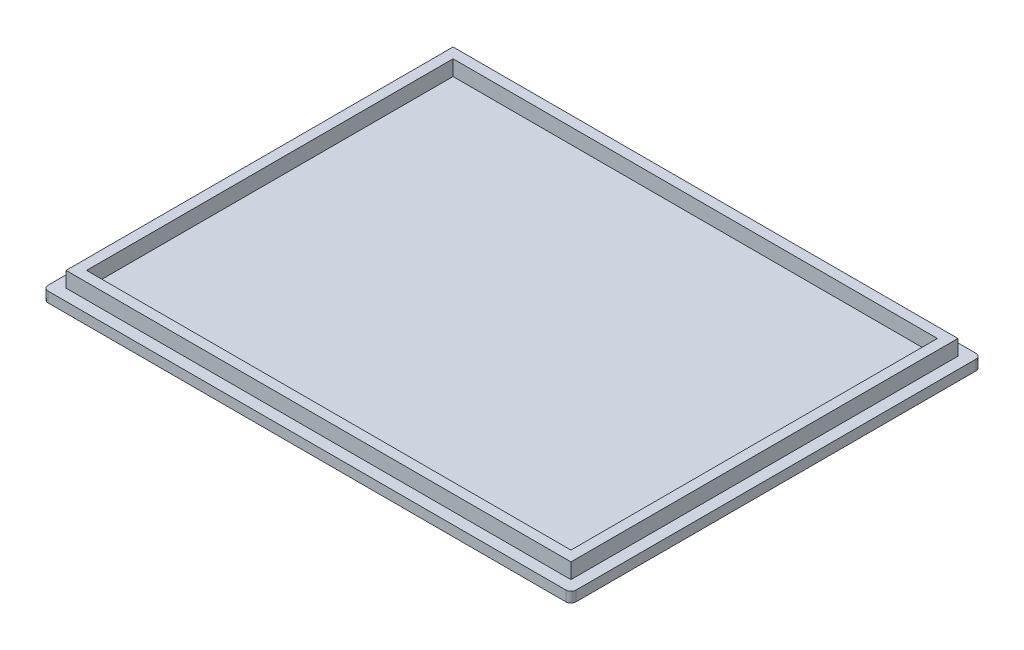
from build123d import *

# Parameters (mm, degrees)
SKETCH1_W           = 261.62
SKETCH1_H           = 203.2
BOSS_EXTRUDE1_DEPTH = 5.08
SKETCH2_W           = 250.19
SKETCH2_H           = 191.77
SKETCH2_W_2         = 240.03
SKETCH2_H_2         = 181.61
BOSS_EXTRUDE2_DEPTH = 7.62
FILLET2_R           = 2.54


with BuildPart() as part:
    # Sketch1 → Boss-Extrude1 (new body)
    with BuildSketch(Plane(origin=(0, 0, 0), x_dir=(1, 0, 0), z_dir=(0, 1, 0))):
        with Locations((130.81, 101.6)):
            Rectangle(SKETCH1_W, SKETCH1_H)
    extrude(amount=BOSS_EXTRUDE1_DEPTH)

    # Sketch2 → Boss-Extrude2 (add)
    with BuildSketch(Plane(origin=(0, 5.08, 0), x_dir=(1, 0, 0), z_dir=(0, 1, 0))):
        with Locations((130.81, 101.6)):
            Rectangle(SKETCH2_W, SKETCH2_H)
        with Locations((130.81, 101.6)):
            Rectangle(SKETCH2_W_2, SKETCH2_H_2, mode=Mode.SUBTRACT)
    extrude(amount=BOSS_EXTRUDE2_DEPTH)

    # Fillet2
    fillet2_edges = [part.edges().sort_by_distance(p)[0] for p in [
        (0, 2.54, -203.2),
        (261.62, 2.54, -203.2),
        (261.62, 2.54, 0),
        (0, 2.54, 0),
    ]]
    fillet(fillet2_edges, radius=FILLET2_R)


solid = part.part
